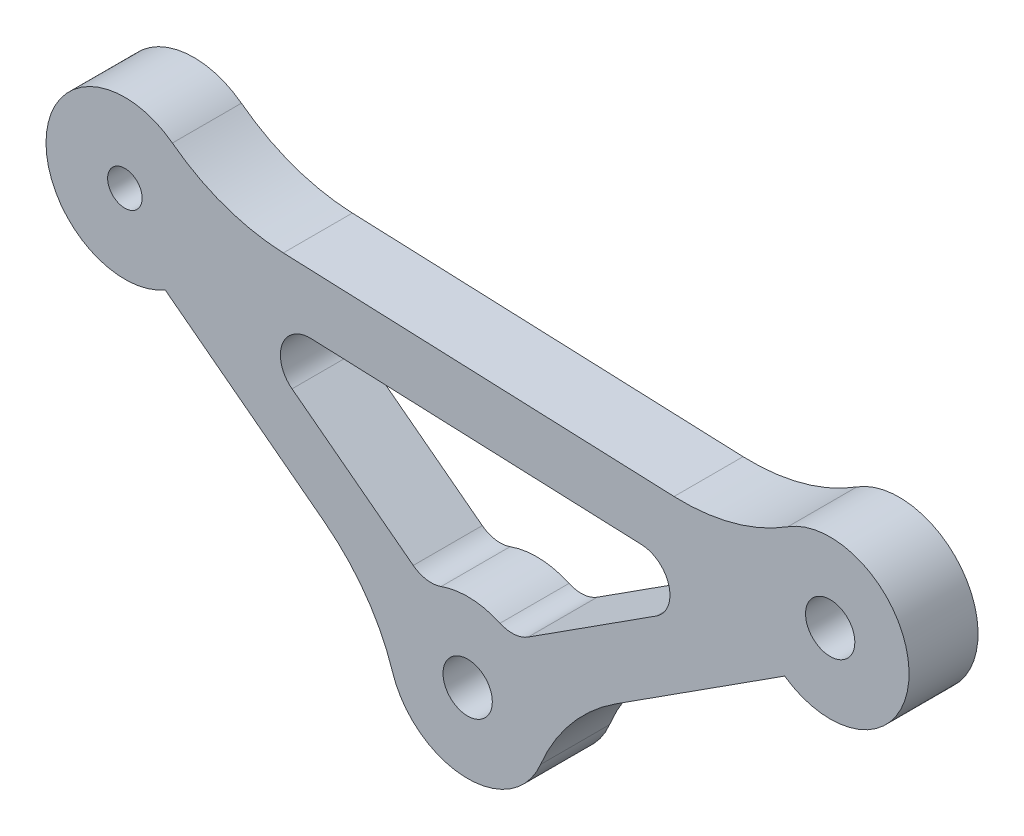
from build123d import *

# Parameters (mm, degrees)
SKETCH2_R             = 8
SKETCH2_R_2           = 2.5
BOSS_EXTRUDE2_DEPTH   = 7
BOSS_EXTRUDE2_2_DEPTH = 7
SKETCH2_R_3           = 1.75
BOSS_EXTRUDE2_3_DEPTH = 7
BOSS_EXTRUDE3_DEPTH   = 7
FILLET4_R             = 3
FILLET5_R             = 20
FILLET6_R             = 20


with BuildPart() as part:
    # Sketch2 → Boss-Extrude2 (new body)
    with BuildSketch(Plane.XY):
        with Locations((-41.051610566, 204.406598272)):
            Circle(SKETCH2_R)
        with Locations((-41.051610566, 204.406598272)):
            Circle(SKETCH2_R_2, mode=Mode.SUBTRACT)
    extrude(amount=BOSS_EXTRUDE2_DEPTH)



with BuildPart() as body_2:
    # Sketch2 → Boss-Extrude2 2 (new body)
    with BuildSketch(Plane.XY):
        with Locations((-4.277553922, 228.026598272)):
            Circle(SKETCH2_R)
        with Locations((-4.277553922, 228.026598272)):
            Circle(SKETCH2_R_2, mode=Mode.SUBTRACT)
    extrude(amount=BOSS_EXTRUDE2_2_DEPTH)


with BuildPart() as body_3:
    # Sketch2 → Boss-Extrude2 3 (new body)
    with BuildSketch(Plane.XY):
        with Locations((-75.824618393, 230.884392152)):
            Circle(SKETCH2_R)
        with Locations((-75.824618394, 230.884392152)):
            Circle(SKETCH2_R_3, mode=Mode.SUBTRACT)
    extrude(amount=BOSS_EXTRUDE2_3_DEPTH)


with BuildPart() as part_1:
    add(part.part)

    add(body_2.part)  # Boss-Extrude3 merges body 2

    add(body_3.part)  # Boss-Extrude3 merges body 3
    # Sketch2<6> → Boss-Extrude3 (add)
    with BuildSketch(Plane.XY):
        with BuildLine():
            ThreePointArc((-36.432963635, 210.938680676), (-34.320479367, 208.730008128), (-33.190406244, 205.890332276))
            Line((-33.190406244, 205.890332276), (-8.896200854, 221.494515869))
            ThreePointArc((-8.896200854, 221.494515869), (-11.997222262, 225.927379197), (-11.568110377, 231.32019609))
            Line((-11.568110377, 231.32019609), (-68.294595771, 233.586013758))
            ThreePointArc((-68.294595771, 233.586013758), (-68.296973695, 228.176151893), (-71.741674269, 224.004743376))
            Line((-71.741674269, 224.004743376), (-48.769430485, 206.512602952))
            ThreePointArc((-48.769430485, 206.512602952), (-47.416469362, 209.253099331), (-45.134554691, 211.286247048))
            Line((-45.134554691, 211.286247048), (-66.437148094, 227.507037612))
            Line((-66.437148094, 227.507037612), (-13.90449039, 225.408733387))
            Line((-13.90449039, 225.408733387), (-36.432963635, 210.938680676))
        make_face()
    extrude(amount=BOSS_EXTRUDE3_DEPTH)

    # Fillet4
    fillet4_edges = [part_1.edges().sort_by_distance(p)[0] for p in [
        (-45.134554691, 211.286247048, 3.5),
        (-36.432963635, 210.938680676, 3.5),
        (-13.90449039, 225.408733387, 3.5),
        (-66.437148094, 227.507037612, 3.5),
    ]]
    fillet(fillet4_edges, radius=FILLET4_R)

    # Fillet5
    fillet5_edges = [part_1.edges().sort_by_distance(p)[0] for p in [
        (-11.568110377, 231.32019609, 3.5),
        (-68.294595771, 233.586013758, 3.5),
    ]]
    fillet(fillet5_edges, radius=FILLET5_R)

    # Fillet6
    fillet6_edges = [part_1.edges().sort_by_distance(p)[0] for p in [
        (-33.190406244, 205.890332276, 3.5),
        (-48.769430485, 206.512602952, 3.5),
    ]]
    fillet(fillet6_edges, radius=FILLET6_R)


solid = part_1.part
